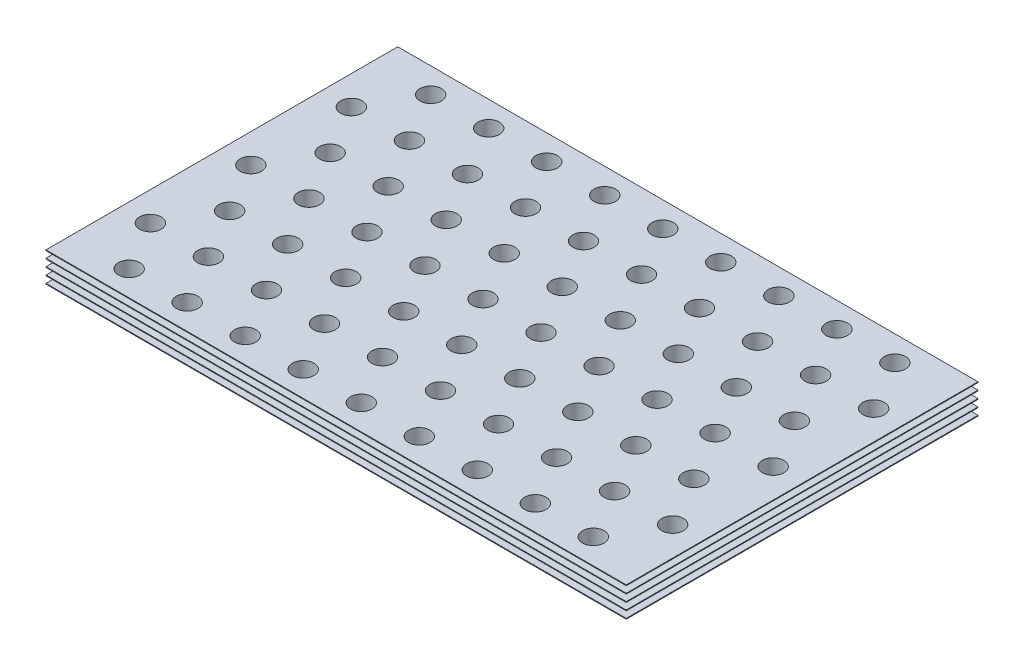
from build123d import *

# Parameters (mm, degrees)
SKETCH1_W            = 254
SKETCH1_H            = 153.9748
BOSS_EXTRUDE1_DEPTH  = 0.3302
LPATTERN1_COUNT      = 5
LPATTERN1_PITCH      = 3.175
BOSS_EXTRUDE2_START  = -12.7
SKETCH2_R            = 5.1054
BOSS_EXTRUDE2_DEPTH  = 12.3698
SKETCH3_R            = 4.708525
CUT_EXTRUDE1_DEPTH   = 150.083352091
LPATTERN2_COUNT      = 9
LPATTERN2_PITCH      = 25.4
LPATTERN2_COUNT_DIR2 = 4
LPATTERN2_PITCH_DIR2 = 43.9928
LPATTERN3_COUNT      = 9
LPATTERN3_PITCH      = 25.4
LPATTERN3_COUNT_DIR2 = 4
LPATTERN3_PITCH_DIR2 = 43.9928
SKETCH4_R            = 5.1054
BOSS_EXTRUDE3_DEPTH  = 13.0302
SKETCH5_R            = 4.708525
CUT_EXTRUDE2_DEPTH   = 150.083352091
LPATTERN4_COUNT      = 10
LPATTERN4_PITCH      = 25.4
LPATTERN4_COUNT_DIR2 = 3
LPATTERN4_PITCH_DIR2 = 43.9928
LPATTERN5_COUNT      = 10
LPATTERN5_PITCH      = 25.4
LPATTERN5_COUNT_DIR2 = 3
LPATTERN5_PITCH_DIR2 = 43.9928


with BuildPart() as part:
    # Sketch1 → Boss-Extrude1 (new body)
    with BuildSketch(Plane(origin=(0, 0, 0), x_dir=(1, 0, 0), z_dir=(0, 1, 0))):
        Rectangle(SKETCH1_W, SKETCH1_H)
    extrude(amount=BOSS_EXTRUDE1_DEPTH)


with BuildPart() as lpattern1_1:
    # LPattern1: pattern copy
    add(part.part.moved(Location(Vector(0, 1, 0) * (1 * LPATTERN1_PITCH))))


with BuildPart() as lpattern1_2:
    # LPattern1: pattern copy
    add(part.part.moved(Location(Vector(0, 1, 0) * (2 * LPATTERN1_PITCH))))


with BuildPart() as lpattern1_3:
    # LPattern1: pattern copy
    add(part.part.moved(Location(Vector(0, 1, 0) * (3 * LPATTERN1_PITCH))))


with BuildPart() as lpattern1_4:
    # LPattern1: pattern copy
    add(part.part.moved(Location(Vector(0, 1, 0) * (4 * LPATTERN1_PITCH))))


with BuildPart() as part_1:
    add(part.part)

    add(lpattern1_1.part)  # Boss-Extrude2 merges LPattern1_1

    add(lpattern1_2.part)  # Boss-Extrude2 merges LPattern1_2

    add(lpattern1_3.part)  # Boss-Extrude2 merges LPattern1_3

    add(lpattern1_4.part)  # Boss-Extrude2 merges LPattern1_4
    # Sketch2 → Boss-Extrude2 (add)
    with BuildSketch(Plane.XZ.offset(BOSS_EXTRUDE2_START)):
        with Locations(Location((101.6, 65.9892, 0), (0, 0, 270))):
            Circle(SKETCH2_R)
    boss_extrude2 = extrude(amount=BOSS_EXTRUDE2_DEPTH)

    # Sketch3 → Cut-Extrude1 (cut, symmetric)
    with BuildSketch(Plane.XZ):
        with Locations(Location((101.6, 65.9892, 0), (0, 0, 270))):
            Circle(SKETCH3_R)
    cut_extrude1 = extrude(amount=CUT_EXTRUDE1_DEPTH, both=True, mode=Mode.SUBTRACT)

    # LPattern2: Boss-Extrude2 9 × 4
    with Locations(*[(-i * LPATTERN2_PITCH, 0, -j * LPATTERN2_PITCH_DIR2) for i in range(LPATTERN2_COUNT) for j in range(LPATTERN2_COUNT_DIR2) if (i, j) != (0, 0)]):
        add(boss_extrude2)

    # LPattern3: Cut-Extrude1 9 × 4
    with Locations(*[(-i * LPATTERN3_PITCH, 0, -j * LPATTERN3_PITCH_DIR2) for i in range(LPATTERN3_COUNT) for j in range(LPATTERN3_COUNT_DIR2) if (i, j) != (0, 0)]):
        add(cut_extrude1, mode=Mode.SUBTRACT)

    # Sketch4 → Boss-Extrude3 (add)
    with BuildSketch(Plane.XZ):
        with Locations(Location((114.3, 43.9928, 0), (0, 0, 90))):
            Circle(SKETCH4_R)
    boss_extrude3 = extrude(amount=-BOSS_EXTRUDE3_DEPTH)

    # Sketch5 → Cut-Extrude2 (cut, through all)
    with BuildSketch(Plane.XZ):
        with Locations(Location((114.3, 43.9928, 0), (0, 0, 270))):
            Circle(SKETCH5_R)
    cut_extrude2 = extrude(amount=-CUT_EXTRUDE2_DEPTH, mode=Mode.SUBTRACT)

    # LPattern4: Boss-Extrude3 10 × 3
    with Locations(*[(-i * LPATTERN4_PITCH, 0, -j * LPATTERN4_PITCH_DIR2) for i in range(LPATTERN4_COUNT) for j in range(LPATTERN4_COUNT_DIR2) if (i, j) != (0, 0)]):
        add(boss_extrude3)

    # LPattern5: Cut-Extrude2 10 × 3
    with Locations(*[(-i * LPATTERN5_PITCH, 0, -j * LPATTERN5_PITCH_DIR2) for i in range(LPATTERN5_COUNT) for j in range(LPATTERN5_COUNT_DIR2) if (i, j) != (0, 0)]):
        add(cut_extrude2, mode=Mode.SUBTRACT)


solid = part_1.part
